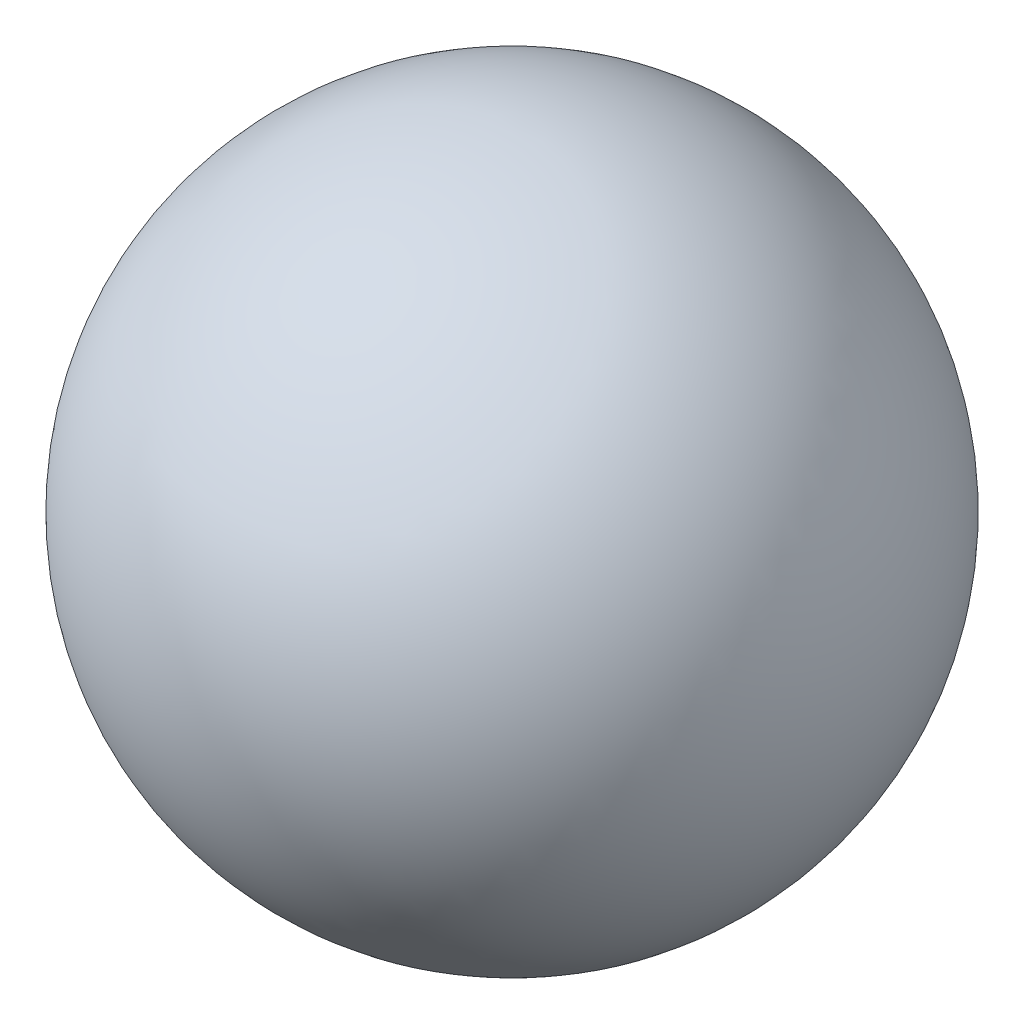
from build123d import *


with BuildPart() as part:
    # ｽｹｯﾁ1 → 回転1 (revolve)
    with BuildSketch(Plane.XY):
        with BuildLine():
            Line((0, 70), (0, -70))
            ThreePointArc((0, -70), (70, 0), (0, 70))
        make_face()
    revolve(axis=Axis((0, 70, 0), (0, -1, 0)))


solid = part.part
